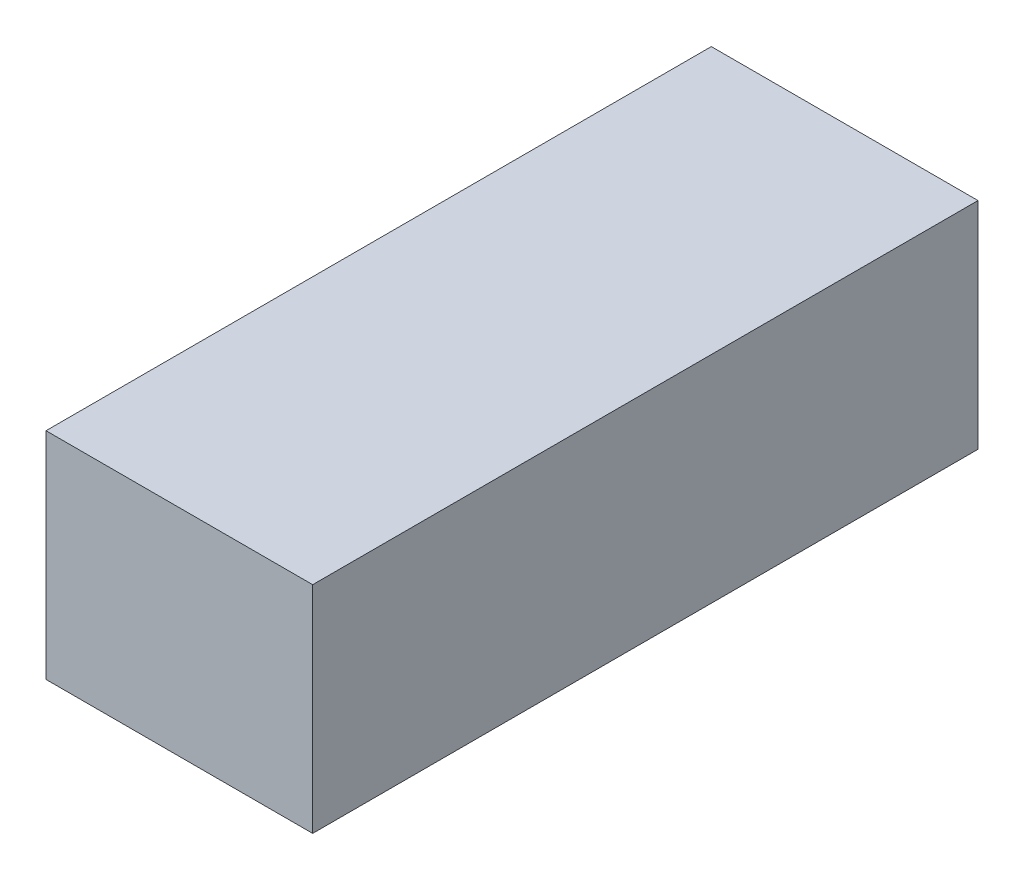
from build123d import *

# Parameters (mm, degrees)
SKETCH1_W           = 27.58
SKETCH1_H           = 68.81
BOSS_EXTRUDE1_DEPTH = 22.28


with BuildPart() as part:
    # Sketch1 → Boss-Extrude1 (new body)
    with BuildSketch(Plane(origin=(0, 0, 0), x_dir=(1, 0, 0), z_dir=(0, 1, 0))):
        Rectangle(SKETCH1_W, SKETCH1_H)
    extrude(amount=BOSS_EXTRUDE1_DEPTH)


solid = part.part
